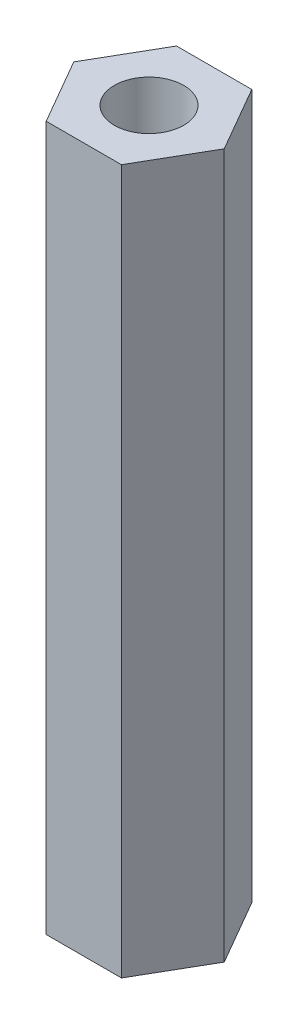
from build123d import *

# Parameters (mm, degrees)
SKETCH1_R           = 1.25
BOSS_EXTRUDE1_DEPTH = 25.4


with BuildPart() as part:
    # Sketch1 → Boss-Extrude1 (new body)
    with BuildSketch(Plane(origin=(0, 0, 0), x_dir=(1, 0, 0), z_dir=(0, 1, 0))):
        Polygon((1.356773133, 2.35), (-1.356773133, 2.35), (-2.713546265, 0), (-1.356773133, -2.35), (1.356773133, -2.35), (2.713546265, 0), align=None)
        with Locations(Location((0, 0, 0), (0, 0, 270))):
            Circle(SKETCH1_R, mode=Mode.SUBTRACT)
    extrude(amount=BOSS_EXTRUDE1_DEPTH)


solid = part.part
